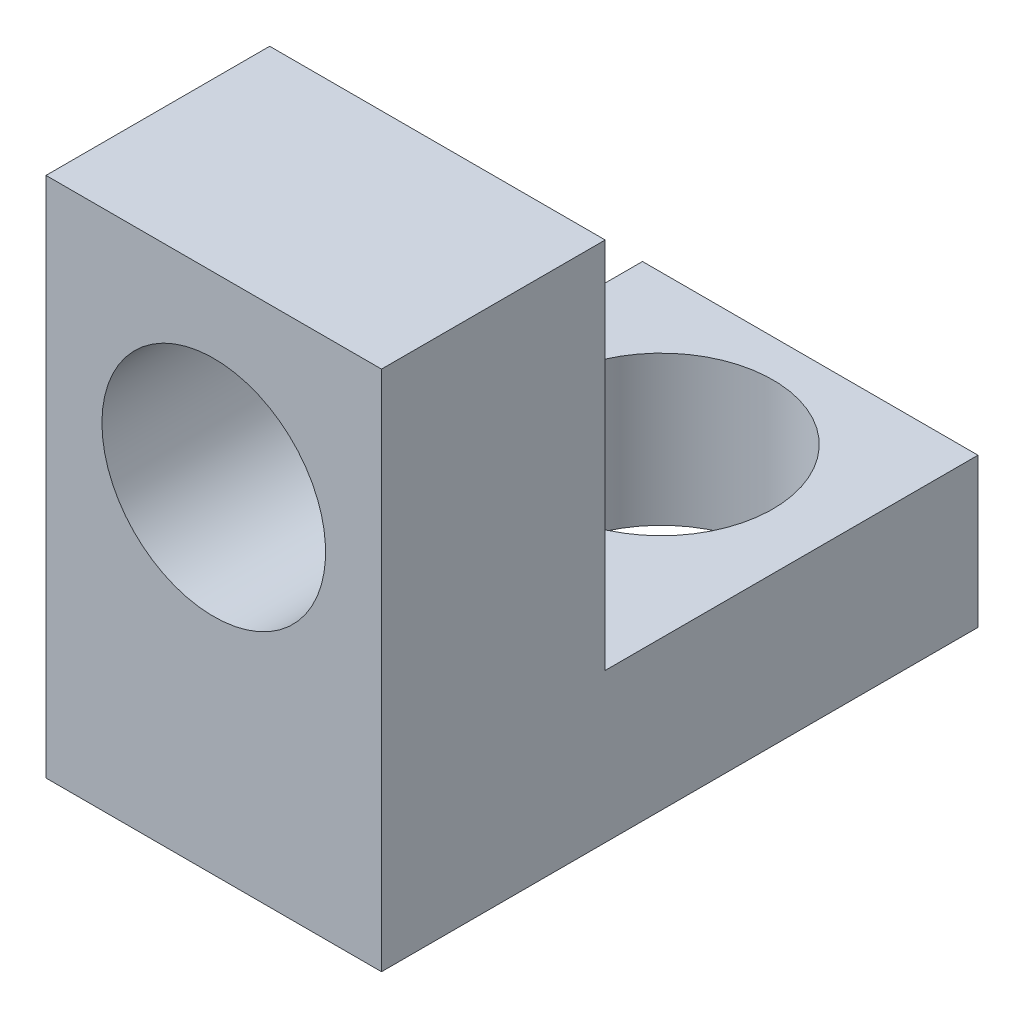
from build123d import *

# Parameters (mm, degrees)
SKETCH1_W           = 4.5
SKETCH1_H           = 8
BOSS_EXTRUDE1_DEPTH = 2
SKETCH2_R           = 1.5
CUT_EXTRUDE1_DEPTH  = 2
SKETCH3_W           = 4.5
SKETCH3_H           = 3
BOSS_EXTRUDE2_DEPTH = 5
SKETCH4_R           = 1.5
CUT_EXTRUDE2_DEPTH  = 5


with BuildPart() as part:
    # Sketch1 → Boss-Extrude1 (new body)
    with BuildSketch(Plane(origin=(0, 0, 0), x_dir=(1, 0, 0), z_dir=(0, 1, 0))):
        Rectangle(SKETCH1_W, SKETCH1_H)
    extrude(amount=BOSS_EXTRUDE1_DEPTH)

    # Sketch2 → Cut-Extrude1 (cut)
    with BuildSketch(Plane(origin=(0, 2, 0), x_dir=(1, 0, 0), z_dir=(0, 1, 0))):
        with Locations(Location((0, 2, 0), (0, 0, 270))):
            Circle(SKETCH2_R)
    extrude(amount=-CUT_EXTRUDE1_DEPTH, mode=Mode.SUBTRACT)

    # Sketch3 → Boss-Extrude2 (add)
    with BuildSketch(Plane(origin=(0, 2, 0), x_dir=(1, 0, 0), z_dir=(0, 1, 0))):
        with Locations((0, -2.5)):
            Rectangle(SKETCH3_W, SKETCH3_H)
    extrude(amount=BOSS_EXTRUDE2_DEPTH)

    # Sketch4 → Cut-Extrude2 (cut)
    with BuildSketch(Plane(origin=(0, 0, 1), x_dir=(-1, 0, 0), z_dir=(0, 0, -1))):
        with Locations((0, 4.5)):
            Circle(SKETCH4_R)
    extrude(amount=-CUT_EXTRUDE2_DEPTH, mode=Mode.SUBTRACT)


solid = part.part
